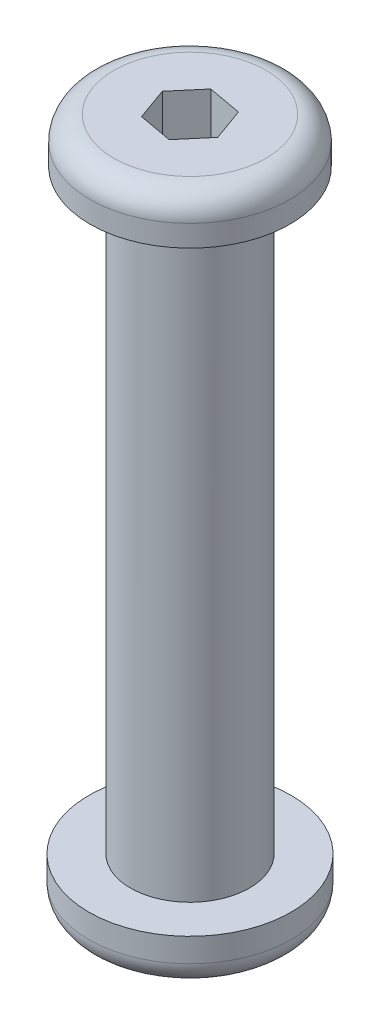
from build123d import *

# Parameters (mm, degrees)
SKETCH_1_R      = 2.5
EXTRUDE_1_DEPTH = 25
SKETCH_2_R      = 4.2
EXTRUDE_2_DEPTH = 1.9
SKETCH_3_R      = 4.25
EXTRUDE_3_DEPTH = 2
FILLET_1_R      = 1


with BuildPart() as part:
    # 草图1 → 凸台-拉伸1 (new body)
    with BuildSketch(Plane(origin=(0, 0, 0), x_dir=(1, 0, 0), z_dir=(0, 1, 0))):
        with Locations(Location((0, 0, 0), (0, 0, 270))):
            Circle(SKETCH_1_R)
    extrude(amount=EXTRUDE_1_DEPTH)

    # 草图2 → 凸台-拉伸2 (add)
    with BuildSketch(Plane(origin=(0, 25, 0), x_dir=(1, 0, 0), z_dir=(0, 1, 0))):
        with Locations(Location((0, 0, 0), (0, 0, 90))):
            Circle(SKETCH_2_R)
        Polygon((0.933529185, 1.100843583), (-0.486593916, 1.358881781), (-1.420123101, 0.258038198), (-0.933529185, -1.100843583), (0.486593916, -1.358881781), (1.420123101, -0.258038198), align=None, mode=Mode.SUBTRACT)
    extrude(amount=EXTRUDE_2_DEPTH)

    # 草图3 → 凸台-拉伸3 (add)
    with BuildSketch(Plane.XZ):
        with Locations(Location((0, 0, 0), (0, 0, 270))):
            Circle(SKETCH_3_R)
        Polygon((0.831789315, 1.179601572), (-0.605670271, 1.310151463), (-1.437459585, 0.130549891), (-0.831789315, -1.179601572), (0.605670271, -1.310151463), (1.437459585, -0.130549891), align=None, mode=Mode.SUBTRACT)
    extrude(amount=EXTRUDE_3_DEPTH)

    # 圆角1
    fillet_1_edges = [part.edges().sort_by_distance(p)[0] for p in [
        (0, 26.9, 4.2),
        (0, -2, 4.25),
    ]]
    fillet(fillet_1_edges, radius=FILLET_1_R)


solid = part.part
